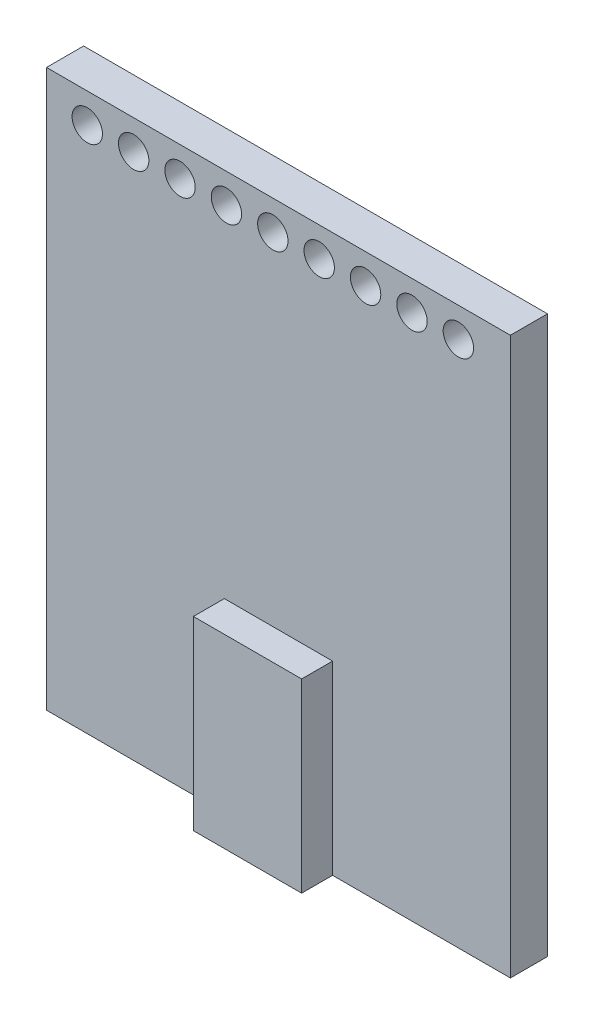
from build123d import *

# Parameters (mm, degrees)
SKETCH1_W           = 15
SKETCH1_H           = 18
BOSS_EXTRUDE1_DEPTH = 1.2
SKETCH2_W           = 3.5
SKETCH2_H           = 6
BOSS_EXTRUDE2_DEPTH = 1
SKETCH3_R           = 0.491511221
CUT_EXTRUDE1_DEPTH  = 1


with BuildPart() as part:
    # Sketch1 → Boss-Extrude1 (new body)
    with BuildSketch(Plane.XY):
        Rectangle(SKETCH1_W, SKETCH1_H)
    extrude(amount=BOSS_EXTRUDE1_DEPTH)

    # Sketch2 → Boss-Extrude2 (add)
    with BuildSketch(Plane.XY.offset(1.2)):
        with Locations((0, -6)):
            Rectangle(SKETCH2_W, SKETCH2_H)
    extrude(amount=BOSS_EXTRUDE2_DEPTH)

    # Sketch3 → Cut-Extrude1 (cut)
    with BuildSketch(Plane.XY.offset(1.2)):
        with Locations((-6.181907245, 8.041418738)):
            Circle(SKETCH3_R)
        with Locations((-4.681907245, 8.041418738)):
            Circle(SKETCH3_R)
        with Locations((-3.181907245, 8.041418738)):
            Circle(SKETCH3_R)
        with Locations((-1.681907245, 8.041418738)):
            Circle(SKETCH3_R)
        with Locations((-0.181907245, 8.041418738)):
            Circle(SKETCH3_R)
        with Locations((1.318092755, 8.041418738)):
            Circle(SKETCH3_R)
        with Locations((2.818092755, 8.041418738)):
            Circle(SKETCH3_R)
        with Locations((4.318092755, 8.041418738)):
            Circle(SKETCH3_R)
        with Locations((5.818092755, 8.041418738)):
            Circle(SKETCH3_R)
    extrude(amount=-CUT_EXTRUDE1_DEPTH, mode=Mode.SUBTRACT)


solid = part.part
